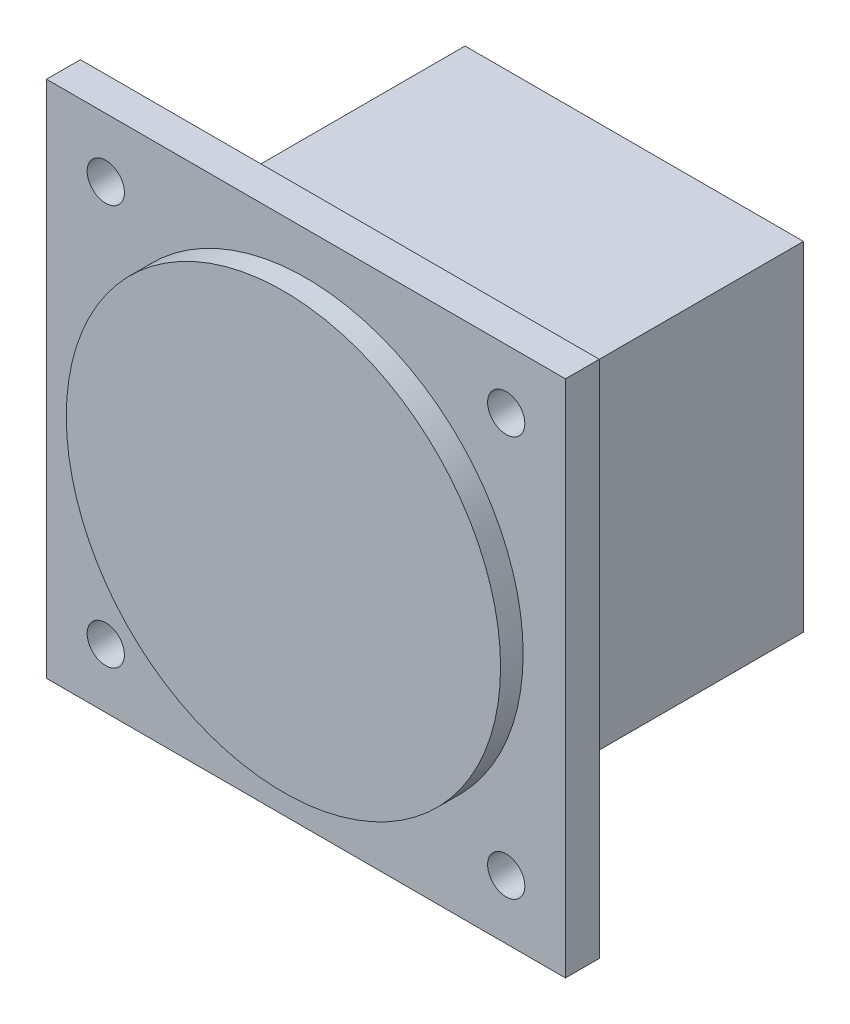
from build123d import *

# Parameters (mm, degrees)
SKETCH1_R           = 20
BOSS_EXTRUDE1_DEPTH = 3
SKETCH2_R           = 19.25
BOSS_EXTRUDE2_DEPTH = 2
SKETCH3_W           = 30
SKETCH3_H           = 30
BOSS_EXTRUDE3_DEPTH = 26.1


with BuildPart() as part:
    # Sketch1 → Boss-Extrude1 (new body)
    # profile 1 of 6: a face of its own
    with BuildSketch(Plane.XY):
        with BuildLine():
            Line((10.050373127, 23), (-10.050373127, 23))
            ThreePointArc((-10.050373127, 23), (-13.456072932, 21.188301047), (-16.54393585, 18.876127426))
            ThreePointArc((-16.54393585, 18.876127426), (-16.213806457, 18.354666777), (-16.098380208, 17.748380208))
            ThreePointArc((-16.098380208, 17.748380208), (-17.091982047, 16.234563358), (-18.876127426, 16.54393585))
            ThreePointArc((-18.876127426, 16.54393585), (-21.188301047, 13.456072932), (-23, 10.050373127))
            Line((-23, 10.050373127), (-23, -10.050373127))
            ThreePointArc((-23, -10.050373127), (-21.188301047, -13.456072932), (-18.876127426, -16.54393585))
            ThreePointArc((-18.876127426, -16.54393585), (-17.091982047, -16.234563358), (-16.098380208, -17.748380208))
            ThreePointArc((-16.098380208, -17.748380208), (-16.213806457, -18.354666777), (-16.54393585, -18.876127426))
            ThreePointArc((-16.54393585, -18.876127426), (-13.456072932, -21.188301047), (-10.050373127, -23))
            Line((-10.050373127, -23), (10.050373127, -23))
            ThreePointArc((10.050373127, -23), (13.456072932, -21.188301047), (16.54393585, -18.876127426))
            ThreePointArc((16.54393585, -18.876127426), (16.581654019, -16.581654019), (18.876127426, -16.54393585))
            ThreePointArc((18.876127426, -16.54393585), (21.188301047, -13.456072932), (23, -10.050373127))
            Line((23, -10.050373127), (23, 10.050373127))
            ThreePointArc((23, 10.050373127), (21.188301047, 13.456072932), (18.876127426, 16.54393585))
            ThreePointArc((18.876127426, 16.54393585), (16.581654019, 16.581654019), (16.54393585, 18.876127426))
            ThreePointArc((16.54393585, 18.876127426), (13.456072932, 21.188301047), (10.050373127, 23))
        make_face()
        Circle(SKETCH1_R, mode=Mode.SUBTRACT)
    # profile 2 of 6: a face of its own
    with BuildSketch(Plane.XY):
        Circle(SKETCH1_R)
    # profile 3 of 6: a face of its own
    with BuildSketch(Plane.XY):
        with BuildLine():
            Line((23, 23), (10.050373127, 23))
            ThreePointArc((10.050373127, 23), (13.456072932, 21.188301047), (16.54393585, 18.876127426))
            ThreePointArc((16.54393585, 18.876127426), (18.354666777, 19.282953958), (19.398380208, 17.748380208))
            ThreePointArc((19.398380208, 17.748380208), (19.262197058, 17.091982047), (18.876127426, 16.54393585))
            ThreePointArc((18.876127426, 16.54393585), (21.188301047, 13.456072932), (23, 10.050373127))
            Line((23, 10.050373127), (23, 23))
        make_face()
    # profile 4 of 6: a face of its own
    with BuildSketch(Plane.XY):
        with BuildLine():
            Line((-10.050373127, 23), (-23, 23))
            Line((-23, 23), (-23, 10.050373127))
            ThreePointArc((-23, 10.050373127), (-21.188301047, 13.456072932), (-18.876127426, 16.54393585))
            ThreePointArc((-18.876127426, 16.54393585), (-18.915106397, 18.915106397), (-16.54393585, 18.876127426))
            ThreePointArc((-16.54393585, 18.876127426), (-13.456072932, 21.188301047), (-10.050373127, 23))
        make_face()
    # profile 5 of 6: a face of its own
    with BuildSketch(Plane.XY):
        with BuildLine():
            Line((23, -23), (23, -10.050373127))
            ThreePointArc((23, -10.050373127), (21.188301047, -13.456072932), (18.876127426, -16.54393585))
            ThreePointArc((18.876127426, -16.54393585), (19.262197058, -17.091982047), (19.398380208, -17.748380208))
            ThreePointArc((19.398380208, -17.748380208), (18.354666777, -19.282953958), (16.54393585, -18.876127426))
            ThreePointArc((16.54393585, -18.876127426), (13.456072932, -21.188301047), (10.050373127, -23))
            Line((10.050373127, -23), (23, -23))
        make_face()
    # profile 6 of 6: a face of its own
    with BuildSketch(Plane.XY):
        with BuildLine():
            ThreePointArc((-18.876127426, -16.54393585), (-21.188301047, -13.456072932), (-23, -10.050373127))
            Line((-23, -10.050373127), (-23, -23))
            Line((-23, -23), (-10.050373127, -23))
            ThreePointArc((-10.050373127, -23), (-13.456072932, -21.188301047), (-16.54393585, -18.876127426))
            ThreePointArc((-16.54393585, -18.876127426), (-18.915106397, -18.915106397), (-18.876127426, -16.54393585))
        make_face()
    extrude(amount=BOSS_EXTRUDE1_DEPTH)

    # Sketch2 → Boss-Extrude2 (add)
    with BuildSketch(Plane.XY.offset(3)):
        Circle(SKETCH2_R)
    extrude(amount=BOSS_EXTRUDE2_DEPTH)

    # Sketch3 → Boss-Extrude3 (add)
    with BuildSketch(Plane(origin=(0, 0, 0), x_dir=(-1, 0, 0), z_dir=(0, 0, -1))):
        Rectangle(SKETCH3_W, SKETCH3_H)
    extrude(amount=BOSS_EXTRUDE3_DEPTH)


solid = part.part
